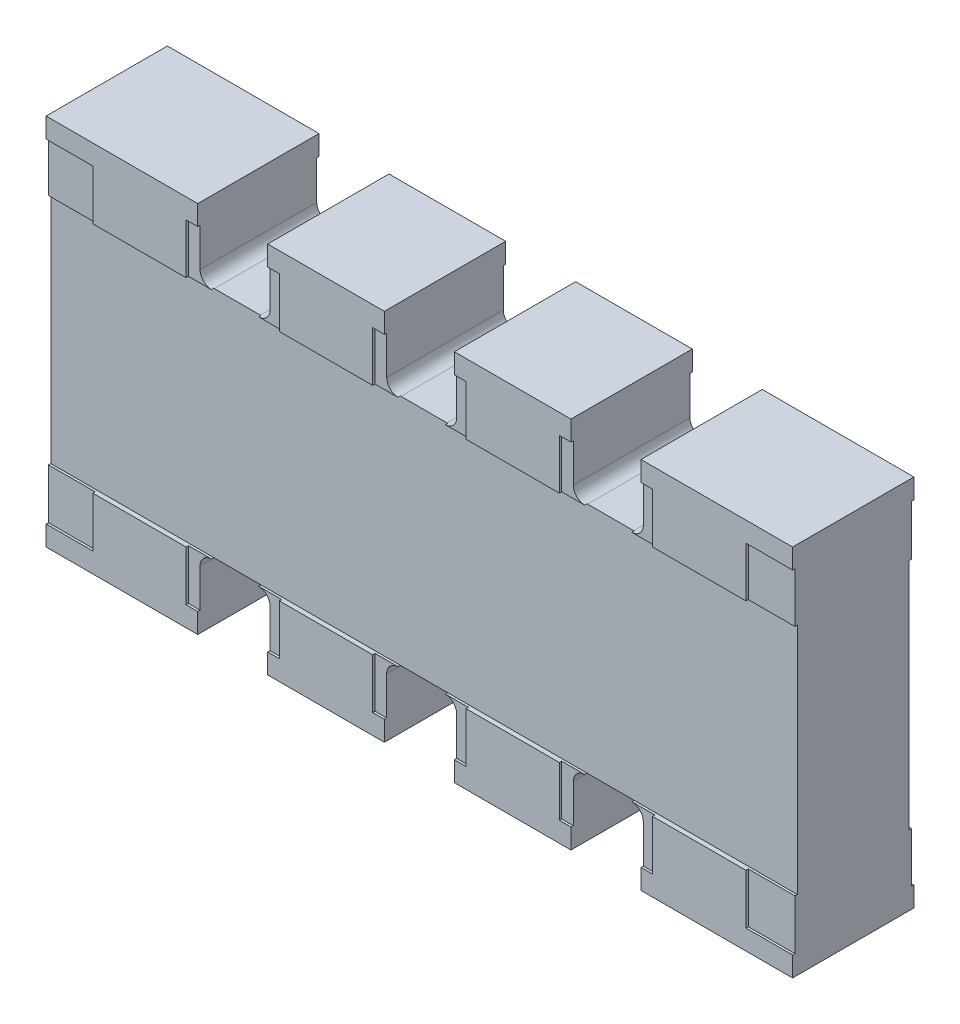
from build123d import *

# Parameters (mm, degrees)
SKETCH1_W           = 3.2
SKETCH1_H           = 1.6
BOSS_EXTRUDE1_DEPTH = 0.5
CUT_EXTRUDE1_DEPTH  = 2.857417562
SKETCH3_W           = 3.2
SKETCH3_H           = 1
CUT_EXTRUDE2_DEPTH  = 0.01
BOSS_EXTRUDE2_DEPTH = 0.01


with BuildPart() as part:
    # Sketch1 → Boss-Extrude1 (new body)
    with BuildSketch(Plane.XY):
        Rectangle(SKETCH1_W, SKETCH1_H)
    extrude(amount=BOSS_EXTRUDE1_DEPTH)

    # Sketch2 → Cut-Extrude1 (cut, through all)
    with BuildSketch(Plane(origin=(0, 0, 0), x_dir=(-1, 0, 0), z_dir=(0, 0, -1))):
        with BuildLine():
            Line((-0.15, 0.8), (0.15, 0.8))
            Line((0.15, 0.8), (0.15, 0.549979938))
            ThreePointArc((0.15, 0.549979938), (0.134862042, 0.514138446), (0.098614632, 0.5))
            Line((0.098614632, 0.5), (-0.098614632, 0.5))
            ThreePointArc((-0.098614632, 0.5), (-0.134862042, 0.514138446), (-0.15, 0.549979938))
            Line((-0.15, 0.549979938), (-0.15, 0.8))
        make_face()
        with BuildLine():
            Line((-0.65, 0.8), (-0.65, 0.549979938))
            ThreePointArc((-0.65, 0.549979938), (-0.665137958, 0.514138446), (-0.701385368, 0.5))
            Line((-0.701385368, 0.5), (-0.898614632, 0.5))
            ThreePointArc((-0.898614632, 0.5), (-0.934862042, 0.514138446), (-0.95, 0.549979938))
            Line((-0.95, 0.549979938), (-0.95, 0.8))
            Line((-0.95, 0.8), (-0.65, 0.8))
        make_face()
        with BuildLine():
            Line((0.95, 0.8), (0.65, 0.8))
            Line((0.65, 0.8), (0.65, 0.549979938))
            ThreePointArc((0.65, 0.549979938), (0.665137958, 0.514138446), (0.701385368, 0.5))
            Line((0.701385368, 0.5), (0.898614632, 0.5))
            ThreePointArc((0.898614632, 0.5), (0.934862042, 0.514138446), (0.95, 0.549979938))
            Line((0.95, 0.549979938), (0.95, 0.8))
        make_face()
        with BuildLine():
            Line((0.65, -0.8), (0.65, -0.549979938))
            ThreePointArc((0.65, -0.549979938), (0.665137958, -0.514138446), (0.701385368, -0.5))
            Line((0.701385368, -0.5), (0.898614632, -0.5))
            ThreePointArc((0.898614632, -0.5), (0.934862042, -0.514138446), (0.95, -0.549979938))
            Line((0.95, -0.549979938), (0.95, -0.8))
            Line((0.95, -0.8), (0.65, -0.8))
        make_face()
        with BuildLine():
            Line((0.15, -0.8), (0.15, -0.549979938))
            ThreePointArc((0.15, -0.549979938), (0.134862042, -0.514138446), (0.098614632, -0.5))
            Line((0.098614632, -0.5), (-0.098614632, -0.5))
            ThreePointArc((-0.098614632, -0.5), (-0.134862042, -0.514138446), (-0.15, -0.549979938))
            Line((-0.15, -0.549979938), (-0.15, -0.8))
            Line((-0.15, -0.8), (0.15, -0.8))
        make_face()
        with BuildLine():
            Line((-0.95, -0.8), (-0.65, -0.8))
            Line((-0.65, -0.8), (-0.65, -0.549979938))
            ThreePointArc((-0.65, -0.549979938), (-0.665137958, -0.514138446), (-0.701385368, -0.5))
            Line((-0.701385368, -0.5), (-0.898614632, -0.5))
            ThreePointArc((-0.898614632, -0.5), (-0.934862042, -0.514138446), (-0.95, -0.549979938))
            Line((-0.95, -0.549979938), (-0.95, -0.8))
        make_face()
    extrude(amount=-CUT_EXTRUDE1_DEPTH, mode=Mode.SUBTRACT)

    # Sketch3 → Cut-Extrude2 (cut)
    with BuildSketch(Plane(origin=(0, 0, 0), x_dir=(-1, 0, 0), z_dir=(0, 0, -1))):
        Rectangle(SKETCH3_W, SKETCH3_H)
    cut_extrude2 = extrude(amount=-CUT_EXTRUDE2_DEPTH, mode=Mode.SUBTRACT)

    # Mirror1: Cut-Extrude2 across plane
    add(cut_extrude2.mirror(Plane(origin=(0, 0, 0.25), x_dir=(1, 0, 0), z_dir=(0, 0, -1))), mode=Mode.SUBTRACT)

    # Sketch4 → Boss-Extrude2 (add)
    with BuildSketch(Plane(origin=(0, 0, 0), x_dir=(-1, 0, 0), z_dir=(0, 0, -1))):
        Polygon((-0.65, 0.71450836), (-0.6, 0.71450836), (-0.6, 0.5), (-0.2, 0.5), (-0.2, 0.71450836), (-0.15, 0.71450836), (-0.15, 0.8), (-0.65, 0.8), align=None)
        Polygon((-1.45, 0.71450836), (-1.4, 0.71450836), (-1.4, 0.5), (-1, 0.5), (-1, 0.71450836), (-0.95, 0.71450836), (-0.95, 0.8), (-1.45, 0.8), (-1.6, 0.8), (-1.6, 0.71450836), align=None)
        Polygon((1.6, 0.8), (1.6, 0.71450836), (1.45, 0.71450836), (1.4, 0.71450836), (1.4, 0.5), (1, 0.5), (1, 0.71450836), (0.95, 0.71450836), (0.95, 0.8), (1.45, 0.8), align=None)
        Polygon((0.6, 0.5), (0.2, 0.5), (0.2, 0.71450836), (0.15, 0.71450836), (0.15, 0.8), (0.65, 0.8), (0.65, 0.71450836), (0.6, 0.71450836), align=None)
        Polygon((1.45, -0.71450836), (1.4, -0.71450836), (1.4, -0.5), (1, -0.5), (1, -0.71450836), (0.95, -0.71450836), (0.95, -0.8), (1.45, -0.8), (1.6, -0.8), (1.6, -0.71450836), align=None)
        Polygon((-1.6, -0.8), (-1.6, -0.71450836), (-1.45, -0.71450836), (-1.4, -0.71450836), (-1.4, -0.5), (-1, -0.5), (-1, -0.71450836), (-0.95, -0.71450836), (-0.95, -0.8), (-1.45, -0.8), align=None)
        Polygon((0.65, -0.71450836), (0.6, -0.71450836), (0.6, -0.5), (0.2, -0.5), (0.2, -0.71450836), (0.15, -0.71450836), (0.15, -0.8), (0.65, -0.8), align=None)
        Polygon((-0.6, -0.5), (-0.2, -0.5), (-0.2, -0.71450836), (-0.15, -0.71450836), (-0.15, -0.8), (-0.65, -0.8), (-0.65, -0.71450836), (-0.6, -0.71450836), align=None)
    boss_extrude2 = extrude(amount=BOSS_EXTRUDE2_DEPTH)

    # Mirror2: Boss-Extrude2 across plane
    add(boss_extrude2.mirror(Plane(origin=(0, 0, 0.25), x_dir=(1, 0, 0), z_dir=(0, 0, -1))))


solid = part.part
